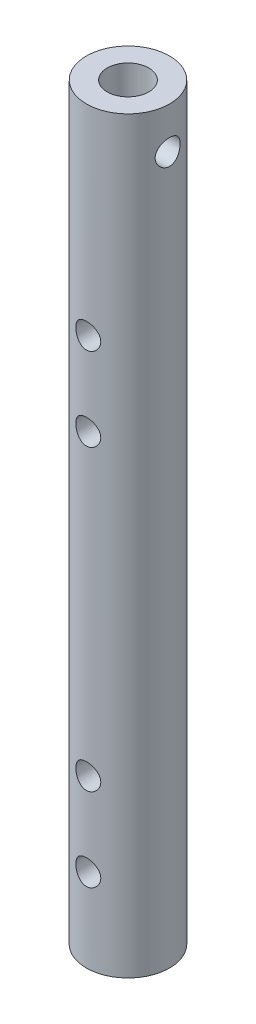
from build123d import *

# Parameters (mm, degrees)
SKETCH1_R               = 5
SKETCH1_R_2             = 2.5
BOSS_EXTRUDE1_DEPTH     = 90
CUT_EXTRUDE1_DEPTH      = 90
CUT_EXTRUDE1_DEPTH_BACK = 90
SKETCH2_R               = 1.5
SKETCH3_R               = 3
CUT_EXTRUDE2_DEPTH      = 7
CUT_EXTRUDE3_DEPTH      = 30
CUT_EXTRUDE3_DEPTH_BACK = 30
SKETCH4_R               = 1.5


with BuildPart() as part:
    # Sketch1 → Boss-Extrude1 (new body)
    with BuildSketch(Plane(origin=(0, 0, 0), x_dir=(1, 0, 0), z_dir=(0, 1, 0))):
        Circle(SKETCH1_R)
        Circle(SKETCH1_R_2, mode=Mode.SUBTRACT)
    extrude(amount=BOSS_EXTRUDE1_DEPTH)

    # Sketch2 → Cut-Extrude1 (cut, two sides: drawn at the far end of the back side and taken through both)
    with BuildSketch(Plane.XY.offset(-CUT_EXTRUDE1_DEPTH_BACK)):
        with Locations((0, 65.87)):
            Circle(SKETCH2_R)
        with Locations((0, 55.87)):
            Circle(SKETCH2_R)
        with Locations((0, 20)):
            Circle(SKETCH2_R)
        with Locations((0, 10)):
            Circle(SKETCH2_R)
    extrude(amount=CUT_EXTRUDE1_DEPTH + CUT_EXTRUDE1_DEPTH_BACK, mode=Mode.SUBTRACT)

    # Sketch3 → Cut-Extrude2 (cut)
    with BuildSketch(Plane.XZ):
        Circle(SKETCH3_R)
    extrude(amount=-CUT_EXTRUDE2_DEPTH, mode=Mode.SUBTRACT)

    # Sketch4 → Cut-Extrude3 (cut, two sides: drawn at the far end of the back side and taken through both)
    with BuildSketch(Plane(origin=(0, 0, 0), x_dir=(0, 0, -1), z_dir=(1, 0, 0)).offset(-CUT_EXTRUDE3_DEPTH_BACK)):
        with Locations((0, 85)):
            Circle(SKETCH4_R)
    extrude(amount=CUT_EXTRUDE3_DEPTH + CUT_EXTRUDE3_DEPTH_BACK, mode=Mode.SUBTRACT)


solid = part.part
